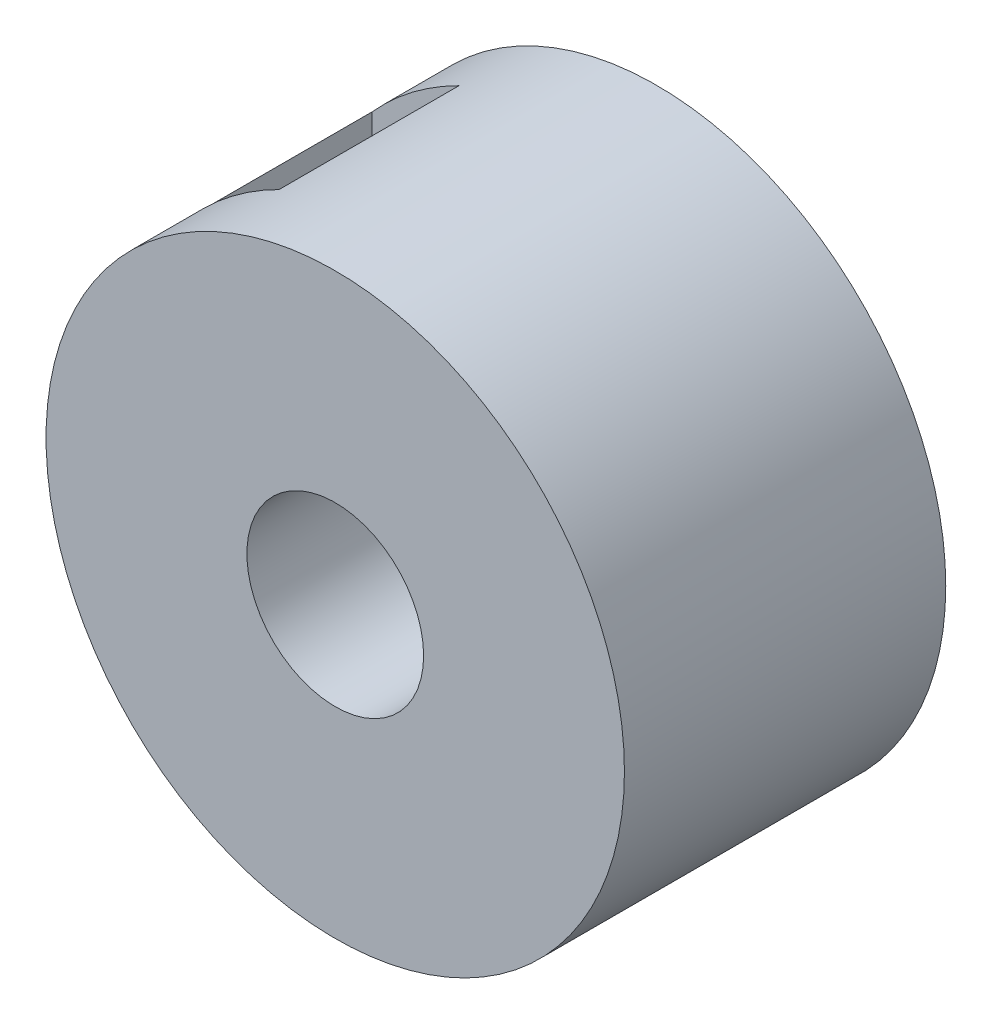
from build123d import *
from OCP.BRepFilletAPI import BRepFilletAPI_MakeChamfer

# Parameters (mm, degrees)
BOSS_EXTRUDE1_DEPTH           = 4.999999888
BOSS_EXTRUDE2_DEPTH           = 9.999999776
CUT_EXTRUDE1_DEPTH            = 24.851816249
DRAFT1_ANGLE                  = 75.657432428
DRAFT2_ANGLE                  = 75.657432428
CHAMFER1_SIZE                 = 0.480269149
CHAMFER1_SIZE2                = 0.480160377
CHAMFER2_SIZE                 = 0.073907777
CHAMFER2_SIZE2                = 0.055643006
CHAMFER3_SIZE                 = 0.073878837
CHAMFER3_SIZE2                = 0.055610332
CHAMFER4_SIZE                 = 0.48025635
CHAMFER4_SIZE2                = 0.480244097
CHAMFER5_SIZE                 = 0.055613272
CHAMFER5_SIZE2                = 0.073938433
CHAMFER6_SIZE                 = 0.073986168
CHAMFER6_SIZE2                = 0.055567841
CHAMFER7_SIZE                 = 0.480229194
CHAMFER7_SIZE2                = 0.480306202
CHAMFER8_SIZE                 = 0.073954803
CHAMFER8_SIZE2                = 0.055594022
CHAMFER9_SIZE                 = 0.480241324
CHAMFER9_SIZE2                = 0.480241311
CHAMFER10_SIZE                = 0.073938433
CHAMFER10_SIZE2               = 0.055613272
CHAMFER11_SIZE                = 0.07396561
CHAMFER11_SIZE2               = 0.055576528
CHAMFER12_SIZE                = 0.055581046
CHAMFER12_SIZE2               = 0.073952971
CHAMFER13_SIZE                = 0.055599635
CHAMFER13_SIZE2               = 0.07394822
CHAMFER14_SIZE                = 0.055610332
CHAMFER14_SIZE2               = 0.073878837
CHAMFER15_SIZE                = 0.05563492
CHAMFER15_SIZE2               = 0.073911301
CHAMFER16_SIZE                = 0.480161244
CHAMFER16_SIZE2               = 0.480232276
CHAMFER17_SIZE                = 0.055643006
CHAMFER17_SIZE2               = 0.073907777
CHAMFER18_SIZE                = 0.073924951
CHAMFER18_SIZE2               = 0.055628248
CHAMFER19_SIZE                = 0.0739466
CHAMFER19_SIZE2               = 0.055593747
CHAMFER20_SIZE                = 0.073930759
CHAMFER20_SIZE2               = 0.055612604
CHAMFER21_SIZE                = 0.055621093
CHAMFER21_SIZE2               = 0.073956166
CHAMFER22_SIZE                = 0.480268533
CHAMFER22_SIZE2               = 0.480228784
CHAMFER23_SIZE                = 0.480160377
CHAMFER23_SIZE2               = 0.480269149
CHAMFER24_SIZE                = 0.055658661
CHAMFER24_SIZE2               = 0.073888826
CHAMFER25_SIZE                = 0.07394822
CHAMFER25_SIZE2               = 0.055599635
CHAMFER26_SIZE                = 0.480263263
CHAMFER26_SIZE2               = 0.480224058
CHAMFER27_SIZE                = 0.055567841
CHAMFER27_SIZE2               = 0.073986168
CHAMFER28_SIZE                = 0.480244097
CHAMFER28_SIZE2               = 0.48025635
CHAMFER29_SIZE                = 0.480224058
CHAMFER29_SIZE2               = 0.480263263
CHAMFER30_SIZE                = 0.073956166
CHAMFER30_SIZE2               = 0.055621093
CHAMFER31_SIZE                = 0.480306202
CHAMFER31_SIZE2               = 0.480229194
CHAMFER32_SIZE                = 0.073888826
CHAMFER32_SIZE2               = 0.055658661
CHAMFER33_SIZE                = 0.055632891
CHAMFER33_SIZE2               = 0.073900635
CHAMFER34_SIZE                = 0.480279358
CHAMFER34_SIZE2               = 0.480241996
CHAMFER35_SIZE                = 0.055594022
CHAMFER35_SIZE2               = 0.073954803
SKETCH8_R                     = 9
SKETCH8_R_2                   = 7
BOSS_EXTRUDE3_DEPTH           = 9.999999776
SKETCH4_R                     = 2.75
F_5_5MMSHAFTHOLE_DEPTH        = 14.999999665
NUTPLACE_DEPTH                = 24.428788184
NUTPLACE_DEPTH_BACK           = 3.3
SKETCH5_W                     = 2.7
SKETCH5_H                     = 5.6
SKETCH6_R                     = 1.6
F_3_3MMSCREWHOLE_FOR_M3_DEPTH = 24.428788184
SKETCH9_R                     = 2.75
CUT_EXTRUDE2_DEPTH            = 0.45


with BuildPart() as part:
    # Sketch1 → Boss-Extrude1 (new body)
    with BuildSketch(Plane.XY.offset(4.999999888)):
        Polygon((0.339522987, -10.429499671), (0.430330598, -9.997780883), (0.413497997, -9.606540203), (1.592849963, -9.482569993), (1.65772755, -9.868826759), (1.836300013, -10.272200219), (2.185299993, -10.811800137), (2.787580015, -11.47999987), (4.063284555, -12.50559645), (4.492539912, -10.925999843), (4.587039817, -10.031400248), (4.552249797, -9.389759973), (4.459627835, -8.95844484), (4.285079893, -8.607819676), (5.312060006, -8.014890365), (5.528453232, -8.341391384), (5.855639931, -8.637240157), (6.39390992, -8.988169953), (7.215910126, -9.353649803), (8.798466061, -9.771706947), (8.548139594, -8.154099807), (8.270599879, -7.29840016), (7.977839559, -6.726390216), (7.71776434, -6.370021747), (7.415730041, -6.120730191), (8.112750016, -5.161359906), (8.443166441, -5.371583994), (8.862470277, -5.508800037), (9.496949613, -5.610470194), (10.396500118, -5.609999876), (12.012343773, -5.348235413), (11.125699617, -3.972290084), (10.524099693, -3.30347009), (10.023999959, -2.89997994), (9.641495157, -2.680225788), (9.264130145, -2.575319959), (9.510680102, -1.415390056), (9.898092934, -1.473045189), (10.33690013, -1.427859999), (10.957900435, -1.262660022), (11.779500172, -0.896346988), (13.149138829, -7.521e-06), (11.779500172, 0.896332029), (10.957900435, 1.26265001), (10.33690013, 1.427839976), (9.898092934, 1.473025166), (9.510680102, 1.415370032), (9.264130145, 2.575319959), (9.641495157, 2.680225788), (10.023999959, 2.89997994), (10.524099693, 3.30347009), (11.125699617, 3.972290084), (12.012343773, 5.348235413), (10.396500118, 5.609999876), (9.496949613, 5.610470194), (8.862470277, 5.508800037), (8.443166441, 5.371583994), (8.112750016, 5.161359906), (7.415730041, 6.120730191), (7.71776434, 6.370021747), (7.977839559, 6.726390216), (8.270599879, 7.29840016), (8.548139594, 8.154099807), (8.798466061, 9.771706947), (7.215910126, 9.353649803), (6.39390992, 8.988169953), (5.855639931, 8.637240157), (5.528453232, 8.341391384), (5.312060006, 8.014890365), (4.285079893, 8.607819676), (4.459627835, 8.95844484), (4.552249797, 9.389759973), (4.587039817, 10.031400248), (4.492539912, 10.925999843), (4.063284555, 12.50559645), (2.787580015, 11.47999987), (2.185299993, 10.811800137), (1.836300013, 10.272200219), (1.65772755, 9.868826759), (1.592849963, 9.482569993), (0.413497997, 9.606540203), (0.430330598, 9.997780883), (0.339522987, 10.429499671), (0.110335997, 11.0298004), (-0.339844002, 11.808699928), (-1.374489965, 13.077052287), (-2.122730017, 11.621300131), (-2.401150065, 10.765899904), (-2.500530099, 10.13099961), (-2.499591845, 9.689898642), (-1.226228432, 9.692607179), (-3.529570065, 8.944179863), (-3.673310552, 9.308462053), (-3.931879997, 9.665950201), (-4.385440145, 10.121099651), (-5.113489926, 10.649500415), (-6.574547579, 11.387529391), (-6.666000001, 9.753170423), (-6.572430022, 8.858470246), (-6.405009888, 8.238100447), (-6.224713953, 7.835442704), (-5.981110036, 7.528789807), (-6.862369832, 6.735320203), (-7.141897192, 7.009681496), (-7.523450069, 7.231030148), (-8.122920059, 7.462389767), (-9.002960287, 7.64897), (-10.637789042, 7.728840668), (-10.056699626, 6.198650226), (-9.607279673, 5.419360008), (-9.202009998, 4.920720123), (-8.873531655, 4.626215205), (-8.526249789, 4.445159808), (-9.008579887, 3.361830022), (-9.375504073, 3.498770202), (-9.8141497, 3.545810003), (-10.455899872, 3.513339907), (-11.335699819, 3.325850004), (-12.861758085, 2.733853221), (-11.708499864, 1.572330017), (-10.980900377, 1.043200027), (-10.407900438, 0.752502005), (-9.988065549, 0.617063222), (-9.597119875, 0.592910976), (-9.597119875, -0.592910976), (-9.988065549, -0.617063222), (-10.407900438, -0.752502005), (-10.980900377, -1.043200027), (-11.708499864, -1.572330017), (-12.861758085, -2.733853221), (-11.335699819, -3.325850004), (-10.455899872, -3.513339907), (-9.8141497, -3.545810003), (-9.375504073, -3.498770202), (-9.008579887, -3.361830022), (-8.526249789, -4.445159808), (-8.873531655, -4.626215205), (-9.202009998, -4.920720123), (-9.607279673, -5.419360008), (-10.056699626, -6.198650226), (-10.637789042, -7.728840668), (-9.002960287, -7.64897), (-8.122920059, -7.462389767), (-7.523450069, -7.231030148), (-7.141897192, -7.009681496), (-6.862369832, -6.735320203), (-5.981110036, -7.528789807), (-6.224713953, -7.835442704), (-6.405009888, -8.238100447), (-6.572430022, -8.858470246), (-6.666000001, -9.753170423), (-6.574547579, -11.387529391), (-5.113489926, -10.649500415), (-4.385440145, -10.121099651), (-3.931879997, -9.665950201), (-3.673310552, -9.308462053), (-3.529570065, -8.944179863), (-1.226228432, -9.692607179), (-2.499591845, -9.689898642), (-2.500530099, -10.13099961), (-2.401150065, -10.765899904), (-2.122730017, -11.621300131), (-1.374489965, -13.077052287), (-0.339844002, -11.808699928), (0.110335997, -11.0298004), align=None)
    extrude(amount=-BOSS_EXTRUDE1_DEPTH)

    # Sketch2 → Boss-Extrude2 (add)
    with BuildSketch(Plane.XY.offset(4.999999888)):
        Polygon((3.749999916, -6.495189853), (1.941140043, -7.244439796), (0, -7.499999832), (-1.941140043, -7.244439796), (-3.749999916, -6.495189853), (-5.303299986, -5.303299986), (-6.495189853, -3.749999916), (-7.244439796, -1.941140043), (-7.499999832, 0), (-7.244439796, 1.941140043), (-6.495189853, 3.749999916), (-5.303299986, 5.303299986), (-3.749999916, 6.495189853), (-1.941140043, 7.244439796), (0, 7.499999832), (1.941140043, 7.244439796), (3.749999916, 6.495189853), (5.303299986, 5.303299986), (6.495189853, 3.749999916), (7.244439796, 1.941140043), (7.499999832, 0), (7.244439796, -1.941140043), (6.495189853, -3.749999916), (5.303299986, -5.303299986), align=None)
    extrude(amount=BOSS_EXTRUDE2_DEPTH)

    # Sketch3 → Cut-Extrude1 (cut, through all)
    with BuildSketch(Plane(origin=(0, 0, 0), x_dir=(-1, 0, 0), z_dir=(0, 0, -1))):
        Polygon((0, 2.499999944), (-1.767770038, 1.767770038), (-2.499999944, 0), (-1.767770038, -1.767770038), (0, -2.499999944), (1.767770038, -1.767770038), (2.499999944, 0), (1.767770038, 1.767770038), align=None)
    extrude(amount=-CUT_EXTRUDE1_DEPTH, mode=Mode.SUBTRACT)

    # Draft1
    draft1_faces = [part.faces().sort_by_distance(p)[0] for p in [
        (-1.862910138, -9.69125291, 2.499999944),
    ]]
    draft(draft1_faces, Plane(origin=(-2.499591845, -9.689898642, 0), x_dir=(-0.0021270688131203317, -0.9999977377865734, 0), z_dir=(-0.9999977377865734, 0.0021270688131203317, 0)), DRAFT1_ANGLE)

    # Draft2
    draft2_faces = [part.faces().sort_by_distance(p)[0] for p in [
        (-1.862910138, 9.69125291, 2.499999944),
    ]]
    draft(draft2_faces, Plane(origin=(-2.500530099, 10.13099961, 0), x_dir=(0.0021270688131095838, -0.9999977377865734, 0), z_dir=(-0.9999977377865734, -0.0021270688131095838, 0)), DRAFT2_ANGLE)

    # Chamfer1
    chamfer1_edges = [part.edges().sort_by_distance(p)[0] for p in [
        (-1.374489965, -13.077052287, 2.499999944),
    ]]
    chamfer1_side = [part.faces().sort_by_distance(p)[0] for p in [
        (-0.857166983, -12.442876108, 2.499999944),
    ]]
    chamfer(chamfer1_edges, length=CHAMFER1_SIZE, length2=CHAMFER1_SIZE2, reference=chamfer1_side[0])

    # Chamfer2
    chamfer2_edges = [part.edges().sort_by_distance(p)[0] for p in [
        (8.443166441, 5.371583994, 2.499999944),
    ]]
    chamfer2_side = [part.faces().sort_by_distance(p)[0] for p in [
        (8.277958229, 5.26647195, 2.499999944),
    ]]
    chamfer(chamfer2_edges, length=CHAMFER2_SIZE, length2=CHAMFER2_SIZE2, reference=chamfer2_side[0])

    # Chamfer3
    chamfer3_edges = [part.edges().sort_by_distance(p)[0] for p in [
        (0.430330598, -9.997780883, 2.499999944),
    ]]
    chamfer3_side = [part.faces().sort_by_distance(p)[0] for p in [
        (0.421914298, -9.802160543, 2.499999944),
    ]]
    chamfer(chamfer3_edges, length=CHAMFER3_SIZE, length2=CHAMFER3_SIZE2, reference=chamfer3_side[0])

    # Chamfer4
    chamfer4_edges = [part.edges().sort_by_distance(p)[0] for p in [
        (8.798466061, 9.771706947, 2.499999944),
    ]]
    chamfer4_side = [part.faces().sort_by_distance(p)[0] for p in [
        (8.673302828, 8.962903377, 2.499999944),
    ]]
    chamfer(chamfer4_edges, length=CHAMFER4_SIZE, length2=CHAMFER4_SIZE2, reference=chamfer4_side[0])

    # Chamfer5
    chamfer5_edges = [part.edges().sort_by_distance(p)[0] for p in [
        (1.65772755, -9.868826759, 2.499999944),
    ]]
    chamfer5_side = [part.faces().sort_by_distance(p)[0] for p in [
        (1.747013781, -10.070513489, 2.499999944),
    ]]
    chamfer(chamfer5_edges, length=CHAMFER5_SIZE, length2=CHAMFER5_SIZE2, reference=chamfer5_side[0])

    # Chamfer6
    chamfer6_edges = [part.edges().sort_by_distance(p)[0] for p in [
        (5.528453232, 8.341391384, 2.499999944),
    ]]
    chamfer6_side = [part.faces().sort_by_distance(p)[0] for p in [
        (5.420256619, 8.178140875, 2.499999944),
    ]]
    chamfer(chamfer6_edges, length=CHAMFER6_SIZE, length2=CHAMFER6_SIZE2, reference=chamfer6_side[0])

    # Chamfer7
    chamfer7_edges = [part.edges().sort_by_distance(p)[0] for p in [
        (4.063284555, -12.50559645, 2.499999944),
    ]]
    chamfer7_side = [part.faces().sort_by_distance(p)[0] for p in [
        (4.277912234, -11.715798146, 2.499999944),
    ]]
    chamfer(chamfer7_edges, length=CHAMFER7_SIZE, length2=CHAMFER7_SIZE2, reference=chamfer7_side[0])

    # Chamfer8
    chamfer8_edges = [part.edges().sort_by_distance(p)[0] for p in [
        (4.459627835, 8.95844484, 2.499999944),
    ]]
    chamfer8_side = [part.faces().sort_by_distance(p)[0] for p in [
        (4.372353864, 8.783132258, 2.499999944),
    ]]
    chamfer(chamfer8_edges, length=CHAMFER8_SIZE, length2=CHAMFER8_SIZE2, reference=chamfer8_side[0])

    # Chamfer9
    chamfer9_edges = [part.edges().sort_by_distance(p)[0] for p in [
        (13.149138829, -7.521e-06, 2.499999944),
    ]]
    chamfer9_side = [part.faces().sort_by_distance(p)[0] for p in [
        (12.4643195, 0.448162254, 2.499999944),
    ]]
    chamfer(chamfer9_edges, length=CHAMFER9_SIZE, length2=CHAMFER9_SIZE2, reference=chamfer9_side[0])

    # Chamfer10
    chamfer10_edges = [part.edges().sort_by_distance(p)[0] for p in [
        (1.65772755, 9.868826759, 2.499999944),
    ]]
    chamfer10_side = [part.faces().sort_by_distance(p)[0] for p in [
        (1.625288757, 9.675698376, 2.499999944),
    ]]
    chamfer(chamfer10_edges, length=CHAMFER10_SIZE, length2=CHAMFER10_SIZE2, reference=chamfer10_side[0])

    # Chamfer11: one chamfer whose edges measure the first distance from different faces: ONE call of the kernel's chamfer builder (chamfer() names one face for all edges)
    chamfer11_edges_1 = [part.edges().sort_by_distance(p)[0] for p in [
        (-7.141897192, -7.009681496, 2.499999944),
    ]]
    chamfer11_side_1 = [part.faces().sort_by_distance(p)[0] for p in [
        (-7.002133512, -6.872500849, 2.499999944),
    ]]
    chamfer11_edges_2 = [part.edges().sort_by_distance(p)[0] for p in [
        (-7.141897192, 7.009681496, 2.499999944),
    ]]
    chamfer11_side_2 = [part.faces().sort_by_distance(p)[0] for p in [
        (-7.33267363, 7.120355822, 2.499999944),
    ]]
    chamfer11 = BRepFilletAPI_MakeChamfer(part.part.solid().wrapped)
    for e in chamfer11_edges_1:
        chamfer11.Add(CHAMFER11_SIZE, CHAMFER11_SIZE2, e.wrapped, chamfer11_side_1[0].wrapped)  # the first distance lies on this face
    for e in chamfer11_edges_2:
        chamfer11.Add(CHAMFER11_SIZE, CHAMFER11_SIZE2, e.wrapped, chamfer11_side_2[0].wrapped)  # the first distance lies on this face
    add(Compound.cast(chamfer11.Shape()), mode=Mode.REPLACE)

    # Chamfer12: one chamfer whose edges measure the first distance from different faces: ONE call of the kernel's chamfer builder (chamfer() names one face for all edges)
    chamfer12_edges_1 = [part.edges().sort_by_distance(p)[0] for p in [
        (-2.499591845, -9.689898642, 2.499999944),
    ]]
    chamfer12_side_1 = [part.faces().sort_by_distance(p)[0] for p in [
        (-2.450675963, -9.500269518, 2.499999944),
    ]]
    chamfer12_edges_2 = [part.edges().sort_by_distance(p)[0] for p in [
        (-2.499591845, 9.689898642, 2.499999944),
    ]]
    chamfer12_side_2 = [part.faces().sort_by_distance(p)[0] for p in [
        (-2.500060972, 9.910449126, 2.499999944),
    ]]
    chamfer12 = BRepFilletAPI_MakeChamfer(part.part.solid().wrapped)
    for e in chamfer12_edges_1:
        chamfer12.Add(CHAMFER12_SIZE, CHAMFER12_SIZE2, e.wrapped, chamfer12_side_1[0].wrapped)  # the first distance lies on this face
    for e in chamfer12_edges_2:
        chamfer12.Add(CHAMFER12_SIZE, CHAMFER12_SIZE2, e.wrapped, chamfer12_side_2[0].wrapped)  # the first distance lies on this face
    add(Compound.cast(chamfer12.Shape()), mode=Mode.REPLACE)

    # Chamfer13
    chamfer13_edges = [part.edges().sort_by_distance(p)[0] for p in [
        (9.898092934, -1.473045189, 2.499999944),
    ]]
    chamfer13_side = [part.faces().sort_by_distance(p)[0] for p in [
        (10.117496532, -1.450452594, 2.499999944),
    ]]
    chamfer(chamfer13_edges, length=CHAMFER13_SIZE, length2=CHAMFER13_SIZE2, reference=chamfer13_side[0])

    # Chamfer14
    chamfer14_edges = [part.edges().sort_by_distance(p)[0] for p in [
        (0.430330598, 9.997780883, 2.499999944),
    ]]
    chamfer14_side = [part.faces().sort_by_distance(p)[0] for p in [
        (0.384926792, 10.213640277, 2.499999944),
    ]]
    chamfer(chamfer14_edges, length=CHAMFER14_SIZE, length2=CHAMFER14_SIZE2, reference=chamfer14_side[0])

    # Chamfer15: one chamfer whose edges measure the first distance from different faces: ONE call of the kernel's chamfer builder (chamfer() names one face for all edges)
    chamfer15_edges_1 = [part.edges().sort_by_distance(p)[0] for p in [
        (-6.224713953, -7.835442704, 2.499999944),
    ]]
    chamfer15_side_1 = [part.faces().sort_by_distance(p)[0] for p in [
        (-6.31486192, -8.036771575, 2.499999944),
    ]]
    chamfer15_edges_2 = [part.edges().sort_by_distance(p)[0] for p in [
        (-6.224713953, 7.835442704, 2.499999944),
    ]]
    chamfer15_side_2 = [part.faces().sort_by_distance(p)[0] for p in [
        (-6.102911995, 7.682116255, 2.499999944),
    ]]
    chamfer15 = BRepFilletAPI_MakeChamfer(part.part.solid().wrapped)
    for e in chamfer15_edges_1:
        chamfer15.Add(CHAMFER15_SIZE, CHAMFER15_SIZE2, e.wrapped, chamfer15_side_1[0].wrapped)  # the first distance lies on this face
    for e in chamfer15_edges_2:
        chamfer15.Add(CHAMFER15_SIZE, CHAMFER15_SIZE2, e.wrapped, chamfer15_side_2[0].wrapped)  # the first distance lies on this face
    add(Compound.cast(chamfer15.Shape()), mode=Mode.REPLACE)

    # Chamfer16: one chamfer whose edges measure the first distance from different faces: ONE call of the kernel's chamfer builder (chamfer() names one face for all edges)
    chamfer16_edges_1 = [part.edges().sort_by_distance(p)[0] for p in [
        (-10.637789042, -7.728840668, 2.499999944),
    ]]
    chamfer16_side_1 = [part.faces().sort_by_distance(p)[0] for p in [
        (-10.347244334, -6.963745447, 2.499999944),
    ]]
    chamfer16_edges_2 = [part.edges().sort_by_distance(p)[0] for p in [
        (-10.637789042, 7.728840668, 2.499999944),
    ]]
    chamfer16_side_2 = [part.faces().sort_by_distance(p)[0] for p in [
        (-9.820374665, 7.688905334, 2.499999944),
    ]]
    chamfer16 = BRepFilletAPI_MakeChamfer(part.part.solid().wrapped)
    for e in chamfer16_edges_1:
        chamfer16.Add(CHAMFER16_SIZE, CHAMFER16_SIZE2, e.wrapped, chamfer16_side_1[0].wrapped)  # the first distance lies on this face
    for e in chamfer16_edges_2:
        chamfer16.Add(CHAMFER16_SIZE, CHAMFER16_SIZE2, e.wrapped, chamfer16_side_2[0].wrapped)  # the first distance lies on this face
    add(Compound.cast(chamfer16.Shape()), mode=Mode.REPLACE)

    # Chamfer17
    chamfer17_edges = [part.edges().sort_by_distance(p)[0] for p in [
        (8.443166441, -5.371583994, 2.499999944),
    ]]
    chamfer17_side = [part.faces().sort_by_distance(p)[0] for p in [
        (8.652818359, -5.440192016, 2.499999944),
    ]]
    chamfer(chamfer17_edges, length=CHAMFER17_SIZE, length2=CHAMFER17_SIZE2, reference=chamfer17_side[0])

    # Chamfer18: one chamfer whose edges measure the first distance from different faces: ONE call of the kernel's chamfer builder (chamfer() names one face for all edges)
    chamfer18_edges_1 = [part.edges().sort_by_distance(p)[0] for p in [
        (-8.873531655, -4.626215205, 2.499999944),
    ]]
    chamfer18_side_1 = [part.faces().sort_by_distance(p)[0] for p in [
        (-9.037770826, -4.773467664, 2.499999944),
    ]]
    chamfer18_edges_2 = [part.edges().sort_by_distance(p)[0] for p in [
        (-8.873531655, 4.626215205, 2.499999944),
    ]]
    chamfer18_side_2 = [part.faces().sort_by_distance(p)[0] for p in [
        (-8.699890722, 4.535687506, 2.499999944),
    ]]
    chamfer18 = BRepFilletAPI_MakeChamfer(part.part.solid().wrapped)
    for e in chamfer18_edges_1:
        chamfer18.Add(CHAMFER18_SIZE, CHAMFER18_SIZE2, e.wrapped, chamfer18_side_1[0].wrapped)  # the first distance lies on this face
    for e in chamfer18_edges_2:
        chamfer18.Add(CHAMFER18_SIZE, CHAMFER18_SIZE2, e.wrapped, chamfer18_side_2[0].wrapped)  # the first distance lies on this face
    add(Compound.cast(chamfer18.Shape()), mode=Mode.REPLACE)

    # Chamfer19: one chamfer whose edges measure the first distance from different faces: ONE call of the kernel's chamfer builder (chamfer() names one face for all edges)
    chamfer19_edges_1 = [part.edges().sort_by_distance(p)[0] for p in [
        (9.641495157, 2.680225788, 2.499999944),
    ]]
    chamfer19_side_1 = [part.faces().sort_by_distance(p)[0] for p in [
        (9.452812651, 2.627772873, 2.499999944),
    ]]
    chamfer19_edges_2 = [part.edges().sort_by_distance(p)[0] for p in [
        (9.641495157, -2.680225788, 2.499999944),
    ]]
    chamfer19_side_2 = [part.faces().sort_by_distance(p)[0] for p in [
        (9.832747558, -2.790102864, 2.499999944),
    ]]
    chamfer19 = BRepFilletAPI_MakeChamfer(part.part.solid().wrapped)
    for e in chamfer19_edges_1:
        chamfer19.Add(CHAMFER19_SIZE, CHAMFER19_SIZE2, e.wrapped, chamfer19_side_1[0].wrapped)  # the first distance lies on this face
    for e in chamfer19_edges_2:
        chamfer19.Add(CHAMFER19_SIZE, CHAMFER19_SIZE2, e.wrapped, chamfer19_side_2[0].wrapped)  # the first distance lies on this face
    add(Compound.cast(chamfer19.Shape()), mode=Mode.REPLACE)

    # Chamfer20: one chamfer whose edges measure the first distance from different faces: ONE call of the kernel's chamfer builder (chamfer() names one face for all edges)
    chamfer20_edges_1 = [part.edges().sort_by_distance(p)[0] for p in [
        (-9.375504073, -3.498770202, 2.499999944),
    ]]
    chamfer20_side_1 = [part.faces().sort_by_distance(p)[0] for p in [
        (-9.19204198, -3.430300112, 2.499999944),
    ]]
    chamfer20_edges_2 = [part.edges().sort_by_distance(p)[0] for p in [
        (-9.375504073, 3.498770202, 2.499999944),
    ]]
    chamfer20_side_2 = [part.faces().sort_by_distance(p)[0] for p in [
        (-9.594826887, 3.522290102, 2.499999944),
    ]]
    chamfer20 = BRepFilletAPI_MakeChamfer(part.part.solid().wrapped)
    for e in chamfer20_edges_1:
        chamfer20.Add(CHAMFER20_SIZE, CHAMFER20_SIZE2, e.wrapped, chamfer20_side_1[0].wrapped)  # the first distance lies on this face
    for e in chamfer20_edges_2:
        chamfer20.Add(CHAMFER20_SIZE, CHAMFER20_SIZE2, e.wrapped, chamfer20_side_2[0].wrapped)  # the first distance lies on this face
    add(Compound.cast(chamfer20.Shape()), mode=Mode.REPLACE)

    # Chamfer21
    chamfer21_edges = [part.edges().sort_by_distance(p)[0] for p in [
        (-9.988065549, 0.617063222, 2.499999944),
    ]]
    chamfer21_side = [part.faces().sort_by_distance(p)[0] for p in [
        (-10.197982994, 0.684782613, 2.499999944),
    ]]
    chamfer(chamfer21_edges, length=CHAMFER21_SIZE, length2=CHAMFER21_SIZE2, reference=chamfer21_side[0])

    # Chamfer22: one chamfer whose edges measure the first distance from different faces: ONE call of the kernel's chamfer builder (chamfer() names one face for all edges)
    chamfer22_edges_1 = [part.edges().sort_by_distance(p)[0] for p in [
        (-12.861758085, -2.733853221, 2.499999944),
    ]]
    chamfer22_side_1 = [part.faces().sort_by_distance(p)[0] for p in [
        (-12.285128974, -2.153091619, 2.499999944),
    ]]
    chamfer22_edges_2 = [part.edges().sort_by_distance(p)[0] for p in [
        (-12.861758085, 2.733853221, 2.499999944),
    ]]
    chamfer22_side_2 = [part.faces().sort_by_distance(p)[0] for p in [
        (-12.285128974, 2.153091619, 2.499999944),
    ]]
    chamfer22 = BRepFilletAPI_MakeChamfer(part.part.solid().wrapped)
    for e in chamfer22_edges_1:
        chamfer22.Add(CHAMFER22_SIZE, CHAMFER22_SIZE2, e.wrapped, chamfer22_side_1[0].wrapped)  # the first distance lies on this face
    for e in chamfer22_edges_2:
        chamfer22.Add(CHAMFER22_SIZE, CHAMFER22_SIZE2, e.wrapped, chamfer22_side_2[0].wrapped)  # the first distance lies on this face
    add(Compound.cast(chamfer22.Shape()), mode=Mode.REPLACE)

    # Chamfer23
    chamfer23_edges = [part.edges().sort_by_distance(p)[0] for p in [
        (-1.374489965, 13.077052287, 2.499999944),
    ]]
    chamfer23_side = [part.faces().sort_by_distance(p)[0] for p in [
        (-1.748609991, 12.349176209, 2.499999944),
    ]]
    chamfer(chamfer23_edges, length=CHAMFER23_SIZE, length2=CHAMFER23_SIZE2, reference=chamfer23_side[0])

    # Chamfer24
    chamfer24_edges = [part.edges().sort_by_distance(p)[0] for p in [
        (-3.673310552, -9.308462053, 2.499999944),
    ]]
    chamfer24_side = [part.faces().sort_by_distance(p)[0] for p in [
        (-3.802595275, -9.487206127, 2.499999944),
    ]]
    chamfer(chamfer24_edges, length=CHAMFER24_SIZE, length2=CHAMFER24_SIZE2, reference=chamfer24_side[0])

    # Chamfer25
    chamfer25_edges = [part.edges().sort_by_distance(p)[0] for p in [
        (9.898092934, 1.473025166, 2.499999944),
    ]]
    chamfer25_side = [part.faces().sort_by_distance(p)[0] for p in [
        (9.704386518, 1.444197599, 2.499999944),
    ]]
    chamfer(chamfer25_edges, length=CHAMFER25_SIZE, length2=CHAMFER25_SIZE2, reference=chamfer25_side[0])

    # Chamfer26
    chamfer26_edges = [part.edges().sort_by_distance(p)[0] for p in [
        (12.012343773, 5.348235413, 2.499999944),
    ]]
    chamfer26_side = [part.faces().sort_by_distance(p)[0] for p in [
        (11.569021695, 4.660262749, 2.499999944),
    ]]
    chamfer(chamfer26_edges, length=CHAMFER26_SIZE, length2=CHAMFER26_SIZE2, reference=chamfer26_side[0])

    # Chamfer27
    chamfer27_edges = [part.edges().sort_by_distance(p)[0] for p in [
        (5.528453232, -8.341391384, 2.499999944),
    ]]
    chamfer27_side = [part.faces().sort_by_distance(p)[0] for p in [
        (5.692046582, -8.48931577, 2.499999944),
    ]]
    chamfer(chamfer27_edges, length=CHAMFER27_SIZE, length2=CHAMFER27_SIZE2, reference=chamfer27_side[0])

    # Chamfer28
    chamfer28_edges = [part.edges().sort_by_distance(p)[0] for p in [
        (8.798466061, -9.771706947, 2.499999944),
    ]]
    chamfer28_side = [part.faces().sort_by_distance(p)[0] for p in [
        (8.007188093, -9.562678375, 2.499999944),
    ]]
    chamfer(chamfer28_edges, length=CHAMFER28_SIZE, length2=CHAMFER28_SIZE2, reference=chamfer28_side[0])

    # Chamfer29
    chamfer29_edges = [part.edges().sort_by_distance(p)[0] for p in [
        (12.012343773, -5.348235413, 2.499999944),
    ]]
    chamfer29_side = [part.faces().sort_by_distance(p)[0] for p in [
        (11.204421945, -5.479117645, 2.499999944),
    ]]
    chamfer(chamfer29_edges, length=CHAMFER29_SIZE, length2=CHAMFER29_SIZE2, reference=chamfer29_side[0])

    # Chamfer30
    chamfer30_edges = [part.edges().sort_by_distance(p)[0] for p in [
        (-9.988065549, -0.617063222, 2.499999944),
    ]]
    chamfer30_side = [part.faces().sort_by_distance(p)[0] for p in [
        (-9.792592712, -0.604987099, 2.499999944),
    ]]
    chamfer(chamfer30_edges, length=CHAMFER30_SIZE, length2=CHAMFER30_SIZE2, reference=chamfer30_side[0])

    # Chamfer31
    chamfer31_edges = [part.edges().sort_by_distance(p)[0] for p in [
        (4.063284555, 12.50559645, 2.499999944),
    ]]
    chamfer31_side = [part.faces().sort_by_distance(p)[0] for p in [
        (3.425432285, 11.99279816, 2.499999944),
    ]]
    chamfer(chamfer31_edges, length=CHAMFER31_SIZE, length2=CHAMFER31_SIZE2, reference=chamfer31_side[0])

    # Chamfer32
    chamfer32_edges = [part.edges().sort_by_distance(p)[0] for p in [
        (-3.673310552, 9.308462053, 2.499999944),
    ]]
    chamfer32_side = [part.faces().sort_by_distance(p)[0] for p in [
        (-3.601440309, 9.126320958, 2.499999944),
    ]]
    chamfer(chamfer32_edges, length=CHAMFER32_SIZE, length2=CHAMFER32_SIZE2, reference=chamfer32_side[0])

    # Chamfer33: one chamfer whose edges measure the first distance from different faces: ONE call of the kernel's chamfer builder (chamfer() names one face for all edges)
    chamfer33_edges_1 = [part.edges().sort_by_distance(p)[0] for p in [
        (7.71776434, 6.370021747, 2.499999944),
    ]]
    chamfer33_side_1 = [part.faces().sort_by_distance(p)[0] for p in [
        (7.84780195, 6.548205982, 2.499999944),
    ]]
    chamfer33_edges_2 = [part.edges().sort_by_distance(p)[0] for p in [
        (7.71776434, -6.370021747, 2.499999944),
    ]]
    chamfer33_side_2 = [part.faces().sort_by_distance(p)[0] for p in [
        (7.56674719, -6.245375969, 2.499999944),
    ]]
    chamfer33 = BRepFilletAPI_MakeChamfer(part.part.solid().wrapped)
    for e in chamfer33_edges_1:
        chamfer33.Add(CHAMFER33_SIZE, CHAMFER33_SIZE2, e.wrapped, chamfer33_side_1[0].wrapped)  # the first distance lies on this face
    for e in chamfer33_edges_2:
        chamfer33.Add(CHAMFER33_SIZE, CHAMFER33_SIZE2, e.wrapped, chamfer33_side_2[0].wrapped)  # the first distance lies on this face
    add(Compound.cast(chamfer33.Shape()), mode=Mode.REPLACE)

    # Chamfer34: one chamfer whose edges measure the first distance from different faces: ONE call of the kernel's chamfer builder (chamfer() names one face for all edges)
    chamfer34_edges_1 = [part.edges().sort_by_distance(p)[0] for p in [
        (-6.574547579, -11.387529391, 2.499999944),
    ]]
    chamfer34_side_1 = [part.faces().sort_by_distance(p)[0] for p in [
        (-5.844018753, -11.018514903, 2.499999944),
    ]]
    chamfer34_edges_2 = [part.edges().sort_by_distance(p)[0] for p in [
        (-6.574547579, 11.387529391, 2.499999944),
    ]]
    chamfer34_side_2 = [part.faces().sort_by_distance(p)[0] for p in [
        (-5.844018753, 11.018514903, 2.499999944),
    ]]
    chamfer34 = BRepFilletAPI_MakeChamfer(part.part.solid().wrapped)
    for e in chamfer34_edges_1:
        chamfer34.Add(CHAMFER34_SIZE, CHAMFER34_SIZE2, e.wrapped, chamfer34_side_1[0].wrapped)  # the first distance lies on this face
    for e in chamfer34_edges_2:
        chamfer34.Add(CHAMFER34_SIZE, CHAMFER34_SIZE2, e.wrapped, chamfer34_side_2[0].wrapped)  # the first distance lies on this face
    add(Compound.cast(chamfer34.Shape()), mode=Mode.REPLACE)

    # Chamfer35
    chamfer35_edges = [part.edges().sort_by_distance(p)[0] for p in [
        (4.459627835, -8.95844484, 2.499999944),
    ]]
    chamfer35_side = [part.faces().sort_by_distance(p)[0] for p in [
        (4.505938816, -9.174102406, 2.499999944),
    ]]
    chamfer(chamfer35_edges, length=CHAMFER35_SIZE, length2=CHAMFER35_SIZE2, reference=chamfer35_side[0])

    # Sketch8 → Boss-Extrude3 (add)
    with BuildSketch(Plane.XY.offset(14.999999665)):
        Circle(SKETCH8_R)
        Circle(SKETCH8_R_2, mode=Mode.SUBTRACT)
    extrude(amount=-BOSS_EXTRUDE3_DEPTH)

    # Sketch4 → 5.5mmShaftHole (cut)
    with BuildSketch(Plane.XY.offset(14.999999665)):
        Circle(SKETCH4_R)
    extrude(amount=-F_5_5MMSHAFTHOLE_DEPTH, mode=Mode.SUBTRACT)

    # Sketch5 → NutPlace (cut, two sides: drawn at the far end of the back side and taken through both)
    with BuildSketch(Plane(origin=(0, 0, 0), x_dir=(1, 0, 0), z_dir=(0, 1, 0)).offset(-NUTPLACE_DEPTH_BACK)):
        with Locations((-5.35, -9.949999665)):
            Rectangle(SKETCH5_W, SKETCH5_H)
    extrude(amount=NUTPLACE_DEPTH + NUTPLACE_DEPTH_BACK, mode=Mode.SUBTRACT)

    # Sketch6 → 3.3mmScrewHole for m3 (cut, through all)
    with BuildSketch(Plane(origin=(0, 0, 0), x_dir=(0, 0, -1), z_dir=(1, 0, 0))):
        with Locations((-9.999999665, 0)):
            Circle(SKETCH6_R)
    extrude(amount=-F_3_3MMSCREWHOLE_FOR_M3_DEPTH, mode=Mode.SUBTRACT)

    # Sketch9 → Cut-Extrude2 (cut)
    with BuildSketch(Plane.ZY.offset(9)):
        with Locations((9.999999665, 0)):
            Circle(SKETCH9_R)
    extrude(amount=-CUT_EXTRUDE2_DEPTH, mode=Mode.SUBTRACT)

    # SurfaceCut1
    split(bisect_by=Plane.XY.offset(4.999999888), keep=Keep.TOP)


solid = part.part
